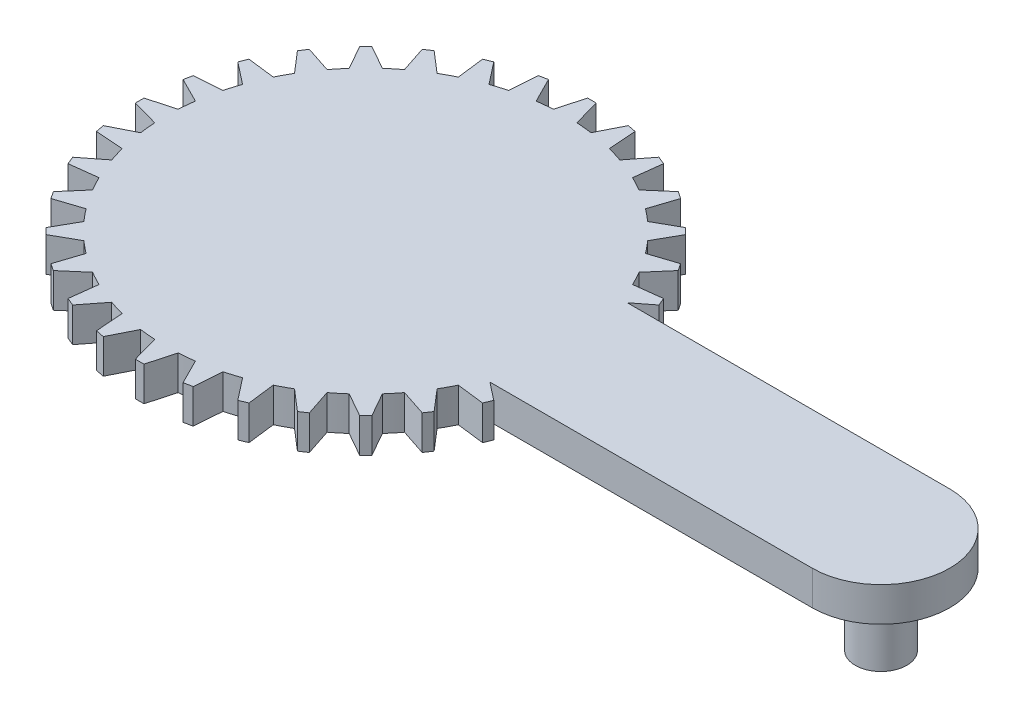
from build123d import *

# Parameters (mm, degrees)
SKETCH3_R           = 2.5
BOSS_EXTRUDE1_DEPTH = 4.15
SKETCH4_R           = 1.5
BOSS_EXTRUDE2_DEPTH = 2
SKETCH4_3_R         = 1.5
BOSS_EXTRUDE3_DEPTH = 2
SKETCH4_5_R         = 1.5
BOSS_EXTRUDE4_DEPTH = 4.15
BOSS_EXTRUDE5_DEPTH = 2
CIRPATTERN1_COUNT   = 32


with BuildPart() as part:
    # Sketch3 → Boss-Extrude1 (new body)
    with BuildSketch(Plane(origin=(0, 0, 0), x_dir=(1, 0, 0), z_dir=(0, 1, 0))):
        with Locations(Location((0, 0, 0), (0, 0, 90))):
            Circle(SKETCH3_R)
    extrude(amount=BOSS_EXTRUDE1_DEPTH)

    # Sketch4 → Boss-Extrude2 (add)
    with BuildSketch(Plane(origin=(0, 4.15, 0), x_dir=(1, 0, 0), z_dir=(0, 1, 0))):
        with BuildLine():
            Line((30, 4), (10.915155748, 4))
            ThreePointArc((10.915155748, 4), (-11.625, 0), (10.915155748, -4))
            Line((10.915155748, -4), (30, -4))
            ThreePointArc((30, -4), (34, 0), (30, 4))
        make_face()
        with Locations(Location((30, 0, 0), (0, 0, 270))):
            Circle(SKETCH4_R, mode=Mode.SUBTRACT)
    extrude(amount=BOSS_EXTRUDE2_DEPTH)

    # Sketch4<3> → Boss-Extrude3 (add)
    with BuildSketch(Plane(origin=(0, 4.15, 0), x_dir=(1, 0, 0), z_dir=(0, 1, 0))):
        with Locations((30, 0)):
            Circle(SKETCH4_3_R)
    extrude(amount=BOSS_EXTRUDE3_DEPTH)

    # Sketch4<5> → Boss-Extrude4 (add)
    with BuildSketch(Plane(origin=(0, 4.15, 0), x_dir=(1, 0, 0), z_dir=(0, 1, 0))):
        with Locations(Location((30, 0, 0), (0, 0, 270))):
            Circle(SKETCH4_5_R)
    extrude(amount=-BOSS_EXTRUDE4_DEPTH)

    # Sketch7 → Boss-Extrude5 (add)
    with BuildSketch(Plane(origin=(0, 6.15, 0), x_dir=(1, 0, 0), z_dir=(0, 1, 0))):
        Polygon((-11.366268694, 0.75), (-11.366268694, -0.75), (-13.166268694, -0.25), (-13.166268694, 0.25), align=None)
    boss_extrude5 = extrude(amount=-BOSS_EXTRUDE5_DEPTH)

    # CirPattern1: Boss-Extrude5 ×32 about axis
    cirpattern1_axis = Axis((0, 0, 0), (0, 1, 0))
    for i in range(1, CIRPATTERN1_COUNT):
        add(boss_extrude5.rotate(cirpattern1_axis, i * 360 / CIRPATTERN1_COUNT))


solid = part.part
